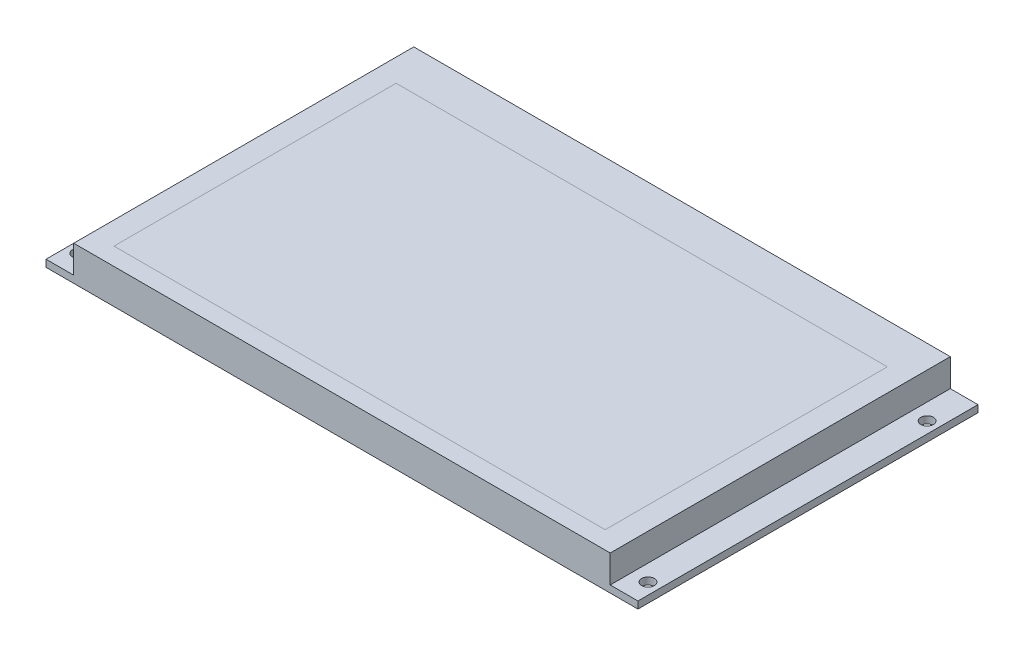
from build123d import *

# Parameters (mm, degrees)
SKETCH_1_W          = 117.5
SKETCH_1_H          = 67.5
EXTRUDE_1_DEPTH     = 1.4
SKETCH_2_W          = 106.5
SKETCH_2_H          = 67.5
EXTRUDE_2_DEPTH     = 5.5
CUT_EXTRUDE_1_REACH = 69.977
SKETCH_5_R          = 1.25
SKETCH_6_W          = 30
SKETCH_6_H          = 6
EXTRUDE_3_DEPTH     = 2


with BuildPart() as part:
    # 草图1 → 凸台-拉伸1 (new body)
    with BuildSketch(Plane(origin=(0, 0, 0), x_dir=(1, 0, 0), z_dir=(0, 1, 0))):
        Rectangle(SKETCH_1_W, SKETCH_1_H)
    extrude(amount=EXTRUDE_1_DEPTH)

    # 草图2 → 凸台-拉伸2 (add)
    with BuildSketch(Plane(origin=(0, 1.4, 0), x_dir=(1, 0, 0), z_dir=(0, 1, 0))):
        Rectangle(SKETCH_2_W, SKETCH_2_H)
    extrude(amount=EXTRUDE_2_DEPTH)

    # 草图5 → 切除-拉伸1 (cut, up to next)
    with BuildSketch(Plane(origin=(0, 1.4, 0), x_dir=(1, 0, 0), z_dir=(0, 1, 0)), mode=Mode.PRIVATE) as cut_extrude_1_sk1:
        with Locations(Location((-56.5, -29.5, 0), (0, 0, 270))):
            Circle(SKETCH_5_R)
    cut_extrude_1_tool1 = extrude(cut_extrude_1_sk1.sketch, amount=-CUT_EXTRUDE_1_REACH, mode=Mode.PRIVATE) & part.part
    # 草图5 → 切除-拉伸1 (cut, up to next)
    with BuildSketch(Plane(origin=(0, 1.4, 0), x_dir=(1, 0, 0), z_dir=(0, 1, 0)), mode=Mode.PRIVATE) as cut_extrude_1_sk2:
        with Locations(Location((-56.5, 25.9, 0), (0, 0, 270))):
            Circle(SKETCH_5_R)
    cut_extrude_1_tool2 = extrude(cut_extrude_1_sk2.sketch, amount=-CUT_EXTRUDE_1_REACH, mode=Mode.PRIVATE) & part.part
    # 草图5 → 切除-拉伸1 (cut, up to next)
    with BuildSketch(Plane(origin=(0, 1.4, 0), x_dir=(1, 0, 0), z_dir=(0, 1, 0)), mode=Mode.PRIVATE) as cut_extrude_1_sk3:
        with Locations(Location((56.5, 25.9, 0), (0, 0, 270))):
            Circle(SKETCH_5_R)
    cut_extrude_1_tool3 = extrude(cut_extrude_1_sk3.sketch, amount=-CUT_EXTRUDE_1_REACH, mode=Mode.PRIVATE) & part.part
    # 草图5 → 切除-拉伸1 (cut, up to next)
    with BuildSketch(Plane(origin=(0, 1.4, 0), x_dir=(1, 0, 0), z_dir=(0, 1, 0)), mode=Mode.PRIVATE) as cut_extrude_1_sk4:
        with Locations(Location((56.5, -29.5, 0), (0, 0, 270))):
            Circle(SKETCH_5_R)
    cut_extrude_1_tool4 = extrude(cut_extrude_1_sk4.sketch, amount=-CUT_EXTRUDE_1_REACH, mode=Mode.PRIVATE) & part.part
    add(cut_extrude_1_tool1.solids().sort_by_distance((-56.5, 1.4, 29.5))[0], mode=Mode.SUBTRACT)
    add(cut_extrude_1_tool2.solids().sort_by_distance((-56.5, 1.4, -25.9))[0], mode=Mode.SUBTRACT)
    add(cut_extrude_1_tool3.solids().sort_by_distance((56.5, 1.4, -25.9))[0], mode=Mode.SUBTRACT)
    add(cut_extrude_1_tool4.solids().sort_by_distance((56.5, 1.4, 29.5))[0], mode=Mode.SUBTRACT)

    # 草图6 → 凸台-拉伸3 (add)
    with BuildSketch(Plane.XZ):
        with Locations((10.25, 27.25)):
            Rectangle(SKETCH_6_W, SKETCH_6_H)
    extrude(amount=EXTRUDE_3_DEPTH)


solid = part.part
